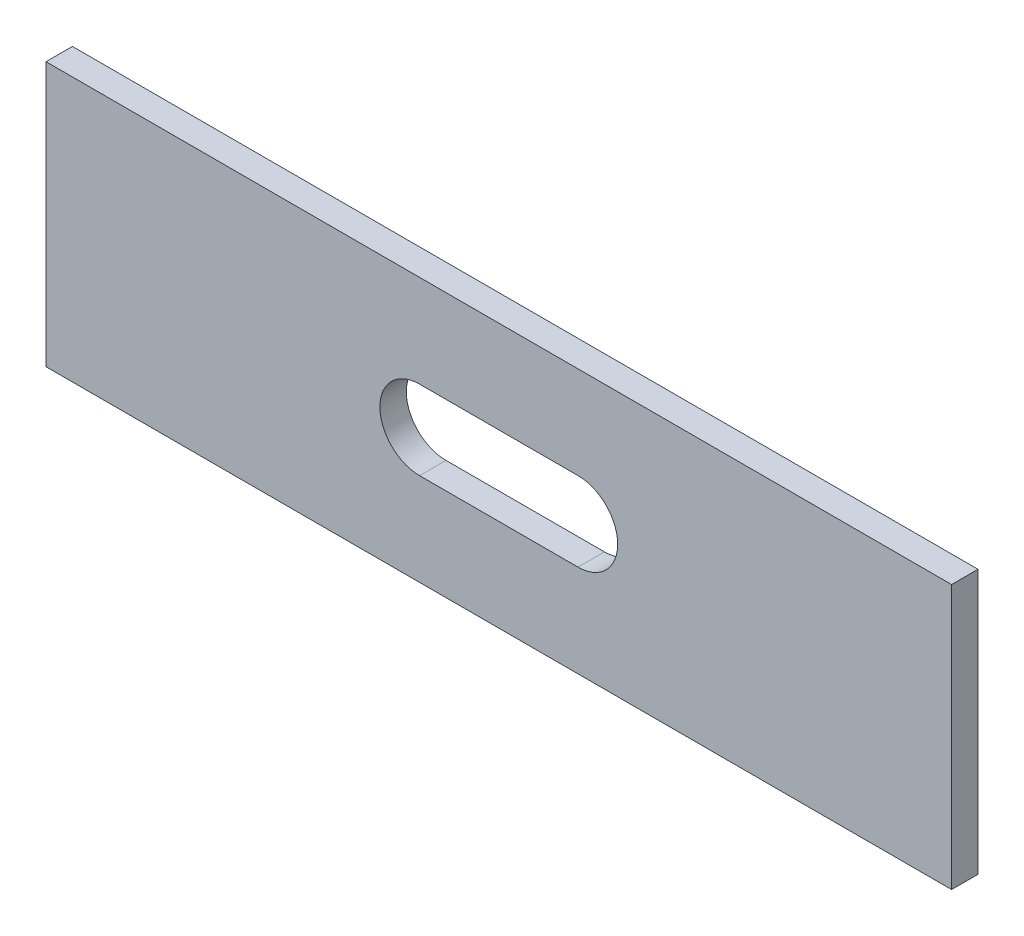
from build123d import *

# Parameters (mm, degrees)
SKETCH1_W               = 217.678
SKETCH1_H               = 63.5
BOSS_EXTRUDE1_DEPTH     = 6.35
CUT_EXTRUDE1_DEPTH      = 114.553128187
CUT_EXTRUDE1_DEPTH_BACK = 114.553128187
SKETCH3_R               = 4.699
CUT_EXTRUDE2_DEPTH      = 5.842


with BuildPart() as part:
    # Sketch1 → Boss-Extrude1 (new body)
    with BuildSketch(Plane.XY):
        Rectangle(SKETCH1_W, SKETCH1_H)
    extrude(amount=BOSS_EXTRUDE1_DEPTH)

    # Sketch2 → Cut-Extrude1 (cut, two sides: drawn at the far end of the back side and taken through both)
    with BuildSketch(Plane.XY.offset(6.35).offset(-CUT_EXTRUDE1_DEPTH_BACK)):
        with BuildLine():
            Line((19.05, -9.525), (-19.05, -9.525))
            ThreePointArc((-19.05, -9.525), (-28.575, 0), (-19.05, 9.525))
            Line((-19.05, 9.525), (19.05, 9.525))
            ThreePointArc((19.05, 9.525), (28.575, 0), (19.05, -9.525))
        make_face()
    extrude(amount=CUT_EXTRUDE1_DEPTH + CUT_EXTRUDE1_DEPTH_BACK, mode=Mode.SUBTRACT)

    # Sketch3 → Cut-Extrude2 (cut)
    with BuildSketch(Plane(origin=(0, 0, 0), x_dir=(-1, 0, 0), z_dir=(0, 0, -1))):
        with Locations((-102.489, 0)):
            Circle(SKETCH3_R)
        with Locations((102.489, 0)):
            Circle(SKETCH3_R)
    extrude(amount=-CUT_EXTRUDE2_DEPTH, mode=Mode.SUBTRACT)


solid = part.part
